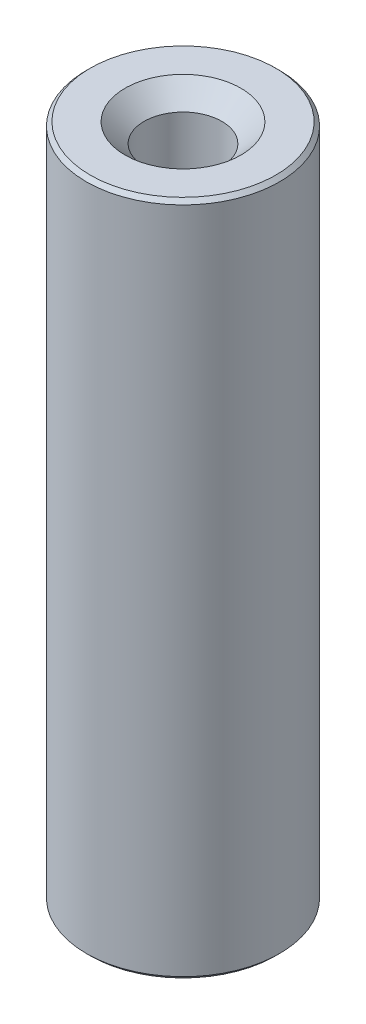
from build123d import *

# Parameters (mm, degrees)
SKETCH1_R           = 6.35
BOSS_EXTRUDE1_DEPTH = 44.45
CHAMFER1_SIZE       = 0.254


with BuildPart() as part:
    # Sketch1 → Boss-Extrude1 (new body)
    with BuildSketch(Plane(origin=(0, 0, 0), x_dir=(1, 0, 0), z_dir=(0, 1, 0))):
        with Locations(Location((0, 0, 0), (0, 0, 270))):
            Circle(SKETCH1_R)
    extrude(amount=BOSS_EXTRUDE1_DEPTH)

    # Sketch3 → 1/4-20 Tapped Hole1 (revolve, cut)
    with BuildSketch(Plane(origin=(0, 44.45, 0), x_dir=(0, 0, 1), z_dir=(1, 0, 0))):
        Polygon((0, 0), (0, 44.45), (3.81, 44.45), (2.5527, 43.1927), (2.5527, 1.2573), (3.81, 0), align=None)
    revolve(axis=Axis((0, 50.8, 0), (0, -1, 0)), mode=Mode.SUBTRACT)

    # Chamfer1
    chamfer1_edges = [part.edges().sort_by_distance(p)[0] for p in [
        (0, 0, -6.35),
        (0, 44.45, -6.35),
    ]]
    chamfer(chamfer1_edges, length=CHAMFER1_SIZE)


solid = part.part
